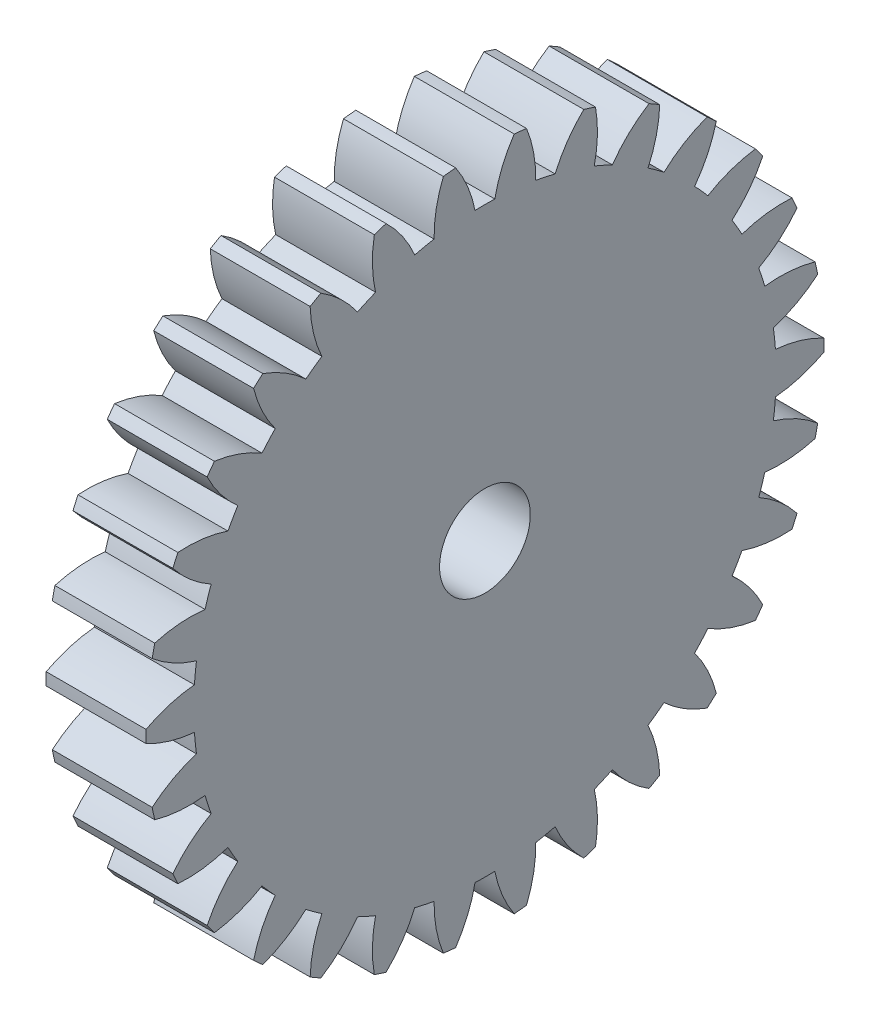
from build123d import *

# Parameters (mm, degrees)
BASPROSKE_W     = 3.3
BASPROSKE_H     = 11.2
TOOTHCUT_DEPTH  = 17.179307773
TEETHCUTS_COUNT = 30
TEETHCUTS_ANGLE = 348
BORSKE_R        = 1.5
BORE_DEPTH      = 50.0000508


with BuildPart() as part:
    # BasProSke → Base-Revolve (revolve)
    with BuildSketch(Plane(origin=(0, 0, 0), x_dir=(1, 0, 0), z_dir=(0, 1, 0)), mode=Mode.PRIVATE) as base_revolve_sk:
        with Locations((1.65, 5.6)):
            Rectangle(BASPROSKE_W, BASPROSKE_H)
    revolve(base_revolve_sk.sketch.rotate(Axis((-10, 0, 0), (1, 0, 0)), 180), axis=Axis((-10, 0, 0), (1, 0, 0)))

    # TooCutSke → ToothCut (cut, through all)
    with BuildSketch(Plane(origin=(0, 0, 0), x_dir=(0, 0, -1), z_dir=(1, 0, 0))):
        with BuildLine():
            ThreePointArc((0.327063784, 9.618440897), (0, 9.624), (-0.327063784, 9.618440897))
            ThreePointArc((-0.327063784, 9.618440897), (-0.575727667, 10.433821081), (-0.983909228, 11.182196913))
            ThreePointArc((-0.983909228, 11.182196913), (0, 11.2254), (0.983909228, 11.182196913))
            ThreePointArc((0.983909228, 11.182196913), (0.575727667, 10.433821081), (0.327063784, 9.618440897))
        make_face()
    toothcut = extrude(amount=TOOTHCUT_DEPTH, mode=Mode.SUBTRACT)

    # TeethCuts: ToothCut ×30 about axis
    teethcuts_axis = Axis((-10, 0, 0), (1, 0, 0))
    for i in range(1, TEETHCUTS_COUNT):
        add(toothcut.rotate(teethcuts_axis, i * TEETHCUTS_ANGLE / (TEETHCUTS_COUNT - 1)), mode=Mode.SUBTRACT)

    # BorSke → Bore (cut, symmetric)
    with BuildSketch(Plane(origin=(0, 0, 0), x_dir=(0, 0, -1), z_dir=(1, 0, 0))):
        with Locations(Location((0, 0, 0), (0, 0, 180))):
            Circle(BORSKE_R)
    extrude(amount=BORE_DEPTH, both=True, mode=Mode.SUBTRACT)


solid = part.part
